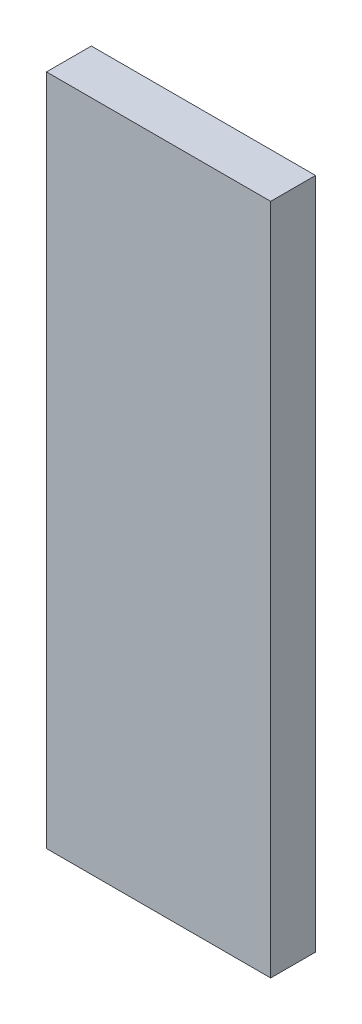
from build123d import *

# Parameters (mm, degrees)
SKETCH1_W           = 100
SKETCH1_H           = 300
BOSS_EXTRUDE1_DEPTH = 20


with BuildPart() as part:
    # Sketch1 → Boss-Extrude1 (new body)
    with BuildSketch(Plane.XY):
        with Locations((-92.788961039, 17.987012987)):
            Rectangle(SKETCH1_W, SKETCH1_H)
    extrude(amount=BOSS_EXTRUDE1_DEPTH)


solid = part.part
